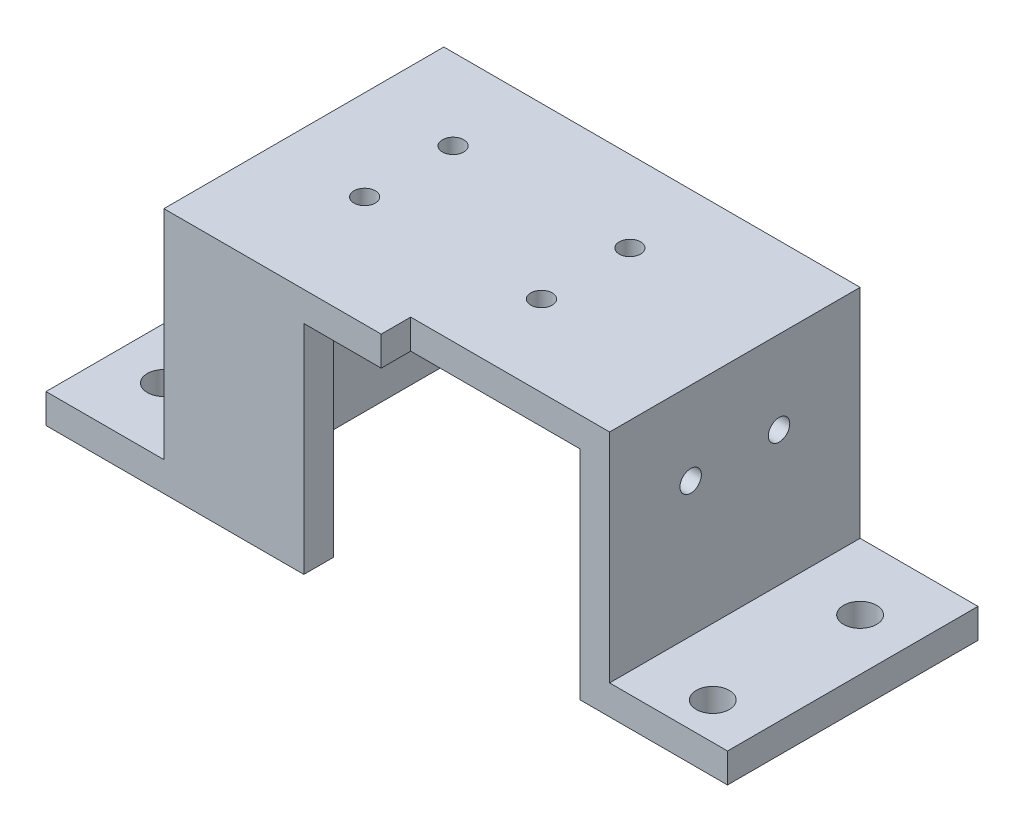
from build123d import *

# Parameters (mm, degrees)
SKETCH_31_W              = 56.5
SKETCH_31_H              = 38
EXTRUDE_11_DEPTH         = 4
SKETCH_32_W              = 4
SKETCH_32_H              = 38
EXTRUDE_12_DEPTH         = 29.5
SKETCH_33_W              = 16
SKETCH_33_H              = 38
EXTRUDE_13_DEPTH         = 4
SKETCH_34_W              = 15
SKETCH_34_H              = 4
EXTRUDE_14_DEPTH         = 29.5
HOLE_WIZARD_M2_5_1_D     = 2.9
HOLE_WIZARD_M2_5_1_DEPTH = 10
HOLE_WIZARD_M2_5_1_TIP   = 0.871247898
HOLE_WIZARD_M2_5_2_D     = 2.9
HOLE_WIZARD_M2_5_2_DEPTH = 10
HOLE_WIZARD_M2_5_2_TIP   = 0.871247898
HOLE_WIZARD_M2_5_3_D     = 2.9
HOLE_WIZARD_M2_5_3_DEPTH = 10
HOLE_WIZARD_M2_5_3_TIP   = 0.871247898
HOLE_WIZARD_M4_1_D       = 4.5
HOLE_WIZARD_M4_1_DEPTH   = 10
HOLE_WIZARD_M4_1_TIP     = 1.351936393
SKETCH_46_W              = 43
SKETCH_46_H              = 33.5
CUT_EXTRUDE_4_DEPTH      = 4


with BuildPart() as part:
    # 스케치31 → 보스-돌출11 (new body)
    with BuildSketch(Plane(origin=(0, 0, 0), x_dir=(1, 0, 0), z_dir=(0, 1, 0))):
        Rectangle(SKETCH_31_W, SKETCH_31_H)
    extrude(amount=EXTRUDE_11_DEPTH)

    # 스케치32 → 보스-돌출12 (add)
    with BuildSketch(Plane.XZ):
        with Locations((26.25, 0)):
            Rectangle(SKETCH_32_W, SKETCH_32_H)
        with Locations((-26.25, 0)):
            Rectangle(SKETCH_32_W, SKETCH_32_H)
    extrude(amount=EXTRUDE_12_DEPTH)

    # 스케치33 → 보스-돌출13 (add)
    with BuildSketch(Plane.XZ.offset(29.5)):
        with Locations((-36.25, 0)):
            Rectangle(SKETCH_33_W, SKETCH_33_H)
        with Locations((36.25, 0)):
            Rectangle(SKETCH_33_W, SKETCH_33_H)
    extrude(amount=-EXTRUDE_13_DEPTH)

    # 스케치34 → 보스-돌출14 (add)
    with BuildSketch(Plane.XZ):
        with Locations((-16.75, 17)):
            Rectangle(SKETCH_34_W, SKETCH_34_H)
    extrude(amount=EXTRUDE_14_DEPTH)

    # M2.5 여유 구멍1
    with Locations(Plane(origin=(0, 4, 0), x_dir=(1, 0, 0), z_dir=(0, 1, 0))):
        with Locations((8, 8), (8, -4), (-16, -4), (-16, 8)):
            Hole(HOLE_WIZARD_M2_5_1_D / 2, depth=HOLE_WIZARD_M2_5_1_DEPTH)
            with Locations((0, 0, -(HOLE_WIZARD_M2_5_1_DEPTH + HOLE_WIZARD_M2_5_1_TIP / 2))):  # 118° drill point
                Cone(0, HOLE_WIZARD_M2_5_1_D / 2, HOLE_WIZARD_M2_5_1_TIP, mode=Mode.SUBTRACT)

    # M2.5 여유 구멍2
    with Locations(Plane(origin=(28.25, 0, 0), x_dir=(0, 0, -1), z_dir=(1, 0, 0))):
        with Locations((-4, -7.25), (8, -7.25)):
            Hole(HOLE_WIZARD_M2_5_2_D / 2, depth=HOLE_WIZARD_M2_5_2_DEPTH)
            with Locations((0, 0, -(HOLE_WIZARD_M2_5_2_DEPTH + HOLE_WIZARD_M2_5_2_TIP / 2))):  # 118° drill point
                Cone(0, HOLE_WIZARD_M2_5_2_D / 2, HOLE_WIZARD_M2_5_2_TIP, mode=Mode.SUBTRACT)

    # M2.5 여유 구멍3
    with Locations(Plane.ZY.offset(28.25)):
        with Locations((4, -7.25), (-8, -7.25)):
            Hole(HOLE_WIZARD_M2_5_3_D / 2, depth=HOLE_WIZARD_M2_5_3_DEPTH)
            with Locations((0, 0, -(HOLE_WIZARD_M2_5_3_DEPTH + HOLE_WIZARD_M2_5_3_TIP / 2))):  # 118° drill point
                Cone(0, HOLE_WIZARD_M2_5_3_D / 2, HOLE_WIZARD_M2_5_3_TIP, mode=Mode.SUBTRACT)

    # M4 여유 구멍1
    with Locations(Plane(origin=(0, -25.5, 0), x_dir=(1, 0, 0), z_dir=(0, 1, 0))):
        with Locations((37.25, 10), (37.25, -10), (-37.25, -10), (-37.25, 10)):
            Hole(HOLE_WIZARD_M4_1_D / 2, depth=HOLE_WIZARD_M4_1_DEPTH)
            with Locations((0, 0, -(HOLE_WIZARD_M4_1_DEPTH + HOLE_WIZARD_M4_1_TIP / 2))):  # 118° drill point
                Cone(0, HOLE_WIZARD_M4_1_D / 2, HOLE_WIZARD_M4_1_TIP, mode=Mode.SUBTRACT)

    # 스케치46 → 컷-돌출4 (cut)
    with BuildSketch(Plane.XY.offset(19)):
        with Locations((22.75, -12.75)):
            Rectangle(SKETCH_46_W, SKETCH_46_H)
    extrude(amount=-CUT_EXTRUDE_4_DEPTH, mode=Mode.SUBTRACT)


solid = part.part
